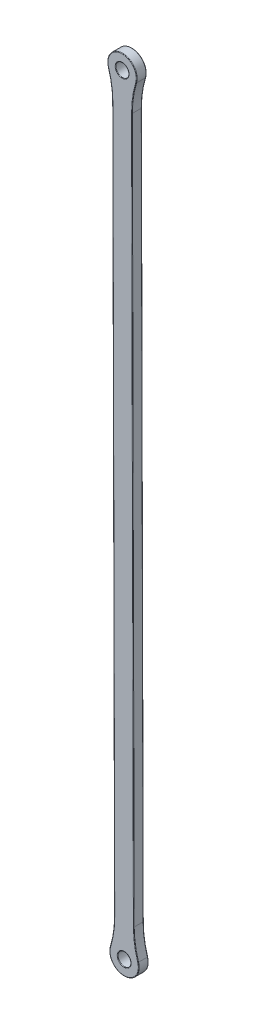
from build123d import *

# Parameters (mm, degrees)
SKETCH1_R           = 2
BOSS_EXTRUDE1_DEPTH = 3
FILLET1_R           = 30
FILLET2_R           = 0.15


with BuildPart() as part:
    # Sketch1 → Boss-Extrude1 (new body)
    with BuildSketch(Plane.XY):
        with BuildLine():
            Line((11.491115757, -3.954385983), (10.880930887, 226.137433673))
            ThreePointArc((10.880930887, 226.137433673), (13.860091969, 233.999463751), (16.880909789, 226.153345131))
            Line((16.880909789, 226.153345131), (17.491094659, -3.938474525))
            ThreePointArc((17.491094659, -3.938474525), (14.511933577, -11.800504602), (11.491115757, -3.954385983))
        make_face()
        with Locations((13.872025562, 229.499479574)):
            Circle(SKETCH1_R, mode=Mode.SUBTRACT)
        with Locations((14.499999983, -7.300520426)):
            Circle(SKETCH1_R, mode=Mode.SUBTRACT)
    extrude(amount=-BOSS_EXTRUDE1_DEPTH)

    # Fillet1
    fillet1_edges = [part.edges().sort_by_distance(p)[0] for p in [
        (10.880930887, 226.137433673, -1.5),
        (16.880909789, 226.153345131, -1.5),
        (17.491094659, -3.938474525, -1.5),
        (11.491115757, -3.954385983, -1.5),
    ]]
    fillet(fillet1_edges, radius=FILLET1_R)

    # Fillet2
    fillet2_edges = [part.edges().sort_by_distance(p)[0] for p in [
        (12.499999983, -7.300520426, 0),
        (11.872025562, 229.499479574, -3),
        (14.511933577, -11.800504602, 0),
        (14.511933577, -11.800504602, -3),
        (17.186002224, 111.107435303, 0),
        (17.186002224, 111.107435303, -3),
        (11.186023322, 111.091523845, 0),
        (11.186023322, 111.091523845, -3),
        (13.860091969, 233.999463751, 0),
        (13.860091969, 233.999463751, -3),
        (17.812912735, -1.652667807, 0),
        (17.812912735, -1.652667807, -3),
        (11.157178744, -1.670318274, 0),
        (11.157178744, -1.670318274, -3),
        (10.559112811, 223.851626955, 0),
        (10.559112811, 223.851626955, -3),
        (17.214846802, 223.869277422, 0),
        (17.214846802, 223.869277422, -3),
        (12.499999983, -7.300520426, -3),
        (11.872025562, 229.499479574, 0),
    ]]
    fillet(fillet2_edges, radius=FILLET2_R)


solid = part.part
